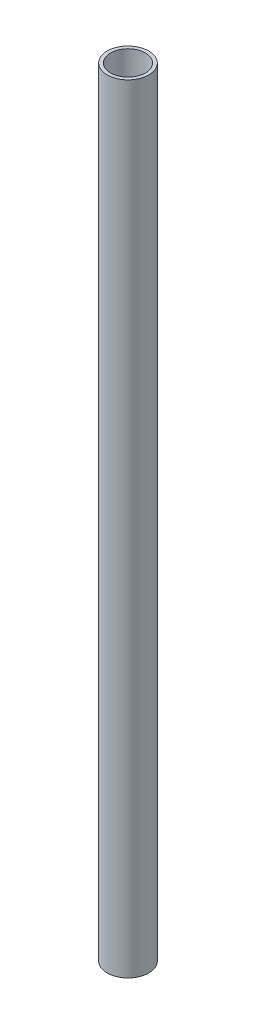
from build123d import *

# Parameters (mm, degrees)
SKETCH1_R           = 7.75
SKETCH1_R_2         = 6.5
BOSS_EXTRUDE1_DEPTH = 270
BOSS_EXTRUDE3_START = -20.476429663
SKETCH1_2_R         = 7.75
SKETCH1_2_R_2       = 6.5
BOSS_EXTRUDE3_DEPTH = 20.476429663


with BuildPart() as part:
    # Sketch1 → Boss-Extrude1 (new body)
    with BuildSketch(Plane(origin=(0, 0, 0), x_dir=(1, 0, 0), z_dir=(0, 1, 0))):
        Circle(SKETCH1_R)
        Circle(SKETCH1_R_2, mode=Mode.SUBTRACT)
    extrude(amount=BOSS_EXTRUDE1_DEPTH)

    # Sketch1<2> → Boss-Extrude3 (add)
    with BuildSketch(Plane(origin=(0, 0, 0), x_dir=(1, 0, 0), z_dir=(0, 1, 0)).offset(BOSS_EXTRUDE3_START)):
        Circle(SKETCH1_2_R)
        Circle(SKETCH1_2_R_2, mode=Mode.SUBTRACT)
    extrude(amount=BOSS_EXTRUDE3_DEPTH)


solid = part.part
